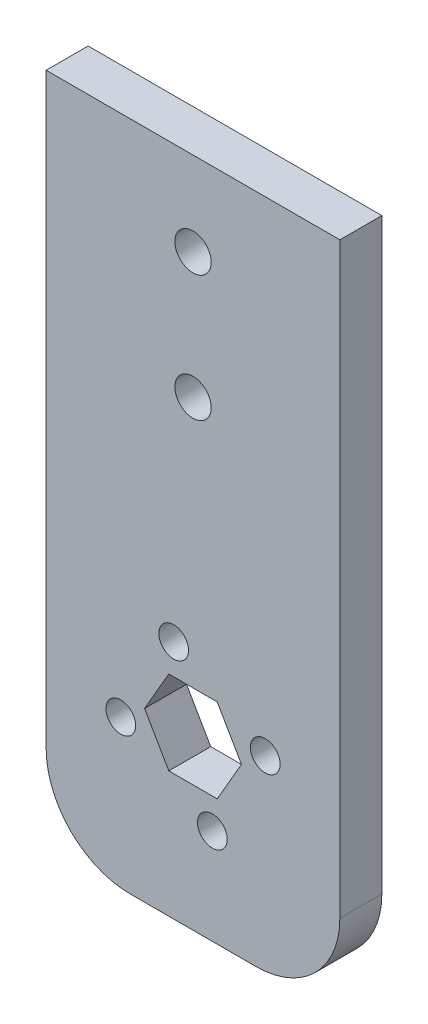
from build123d import *

# Parameters (mm, degrees)
SKETCH1_W            = 44.45
SKETCH1_H            = 101.6
BOSS_EXTRUDE2_DEPTH  = 6.35
FILLET1_R            = 12.7
M5_CLEARANCE_HOLE1_D = 5.5
CUT_EXTRUDE1_DEPTH   = 112.079633597
M4_CLEARANCE_HOLE1_D = 4.5


with BuildPart() as part:
    # Sketch1 → Boss-Extrude2 (new body)
    with BuildSketch(Plane.XY):
        with Locations((-22.225, 50.8)):
            Rectangle(SKETCH1_W, SKETCH1_H)
    extrude(amount=BOSS_EXTRUDE2_DEPTH)

    # Fillet1
    fillet1_edges = [part.edges().sort_by_distance(p)[0] for p in [
        (0, 0, 3.175),
        (-44.45, 0, 3.175),
    ]]
    fillet(fillet1_edges, radius=FILLET1_R)

    # M5 Clearance Hole1 (through all)
    with Locations(Plane(origin=(0, 0, 0), x_dir=(-1, 0, 0), z_dir=(0, 0, -1))):
        with Locations((22.225, 88.9), (22.225, 69.85)):
            Hole(M5_CLEARANCE_HOLE1_D / 2)

    # Sketch14 → Cut-Extrude1 (cut, through all)
    with BuildSketch(Plane.XY.offset(6.35)):
        Polygon((-14.892651581, 25.4), (-18.558825791, 31.75), (-25.891174209, 31.75), (-29.557348419, 25.4), (-25.891174209, 19.05), (-18.558825791, 19.05), align=None)
    extrude(amount=-CUT_EXTRUDE1_DEPTH, mode=Mode.SUBTRACT)

    # M4 Clearance Hole1 (through all)
    with Locations(Plane(origin=(0, 0, 0), x_dir=(-1, 0, 0), z_dir=(0, 0, -1))):
        with Locations((11.29679677, 28.32820323), (25.15320323, 36.32820323), (33.15320323, 22.47179677), (19.29679677, 14.47179677)):
            Hole(M4_CLEARANCE_HOLE1_D / 2)


solid = part.part
